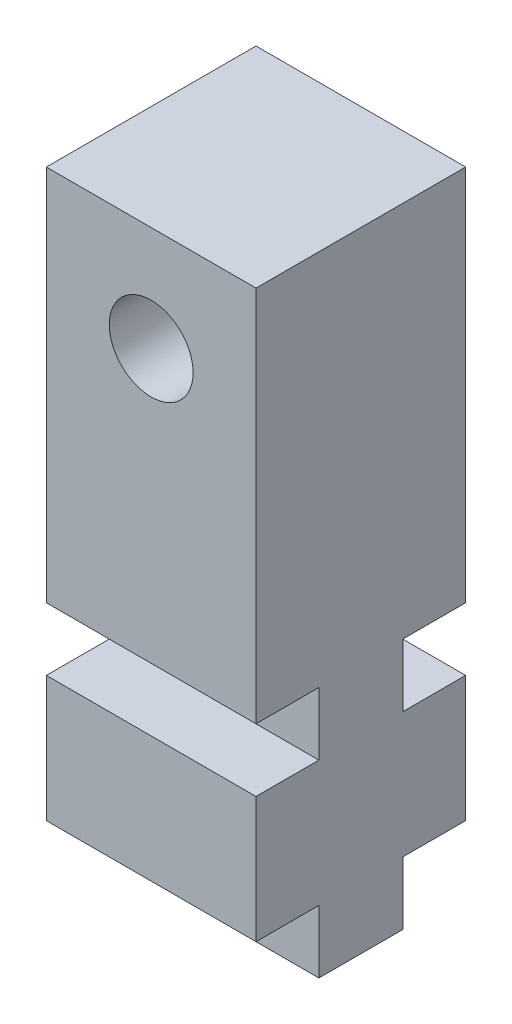
from build123d import *

# Parameters (mm, degrees)
SKETCH2_W           = 5
SKETCH2_H           = 15
SKETCH2_R           = 1
BOSS_EXTRUDE1_DEPTH = 2.5
SKETCH3_W           = 1.5
SKETCH3_H           = 1.5
CUT_EXTRUDE1_DEPTH  = 10.354143467


with BuildPart() as part:
    # Sketch2 → Boss-Extrude1 (new, symmetric)
    with BuildSketch(Plane.XY):
        Rectangle(SKETCH2_W, SKETCH2_H)
        with Locations((0, 5)):
            Circle(SKETCH2_R, mode=Mode.SUBTRACT)
    extrude(amount=BOSS_EXTRUDE1_DEPTH, both=True)

    # Sketch3 → Cut-Extrude1 (cut, through all)
    with BuildSketch(Plane(origin=(2.5, 0, 0), x_dir=(0, 0, -1), z_dir=(1, 0, 0))):
        with Locations((-1.75, -2.25)):
            Rectangle(SKETCH3_W, SKETCH3_H)
        with Locations((-1.75, -6.75)):
            Rectangle(SKETCH3_W, SKETCH3_H)
        with Locations((1.75, -6.75)):
            Rectangle(SKETCH3_W, SKETCH3_H)
        with Locations((1.75, -2.25)):
            Rectangle(SKETCH3_W, SKETCH3_H)
    extrude(amount=-CUT_EXTRUDE1_DEPTH, mode=Mode.SUBTRACT)


solid = part.part
